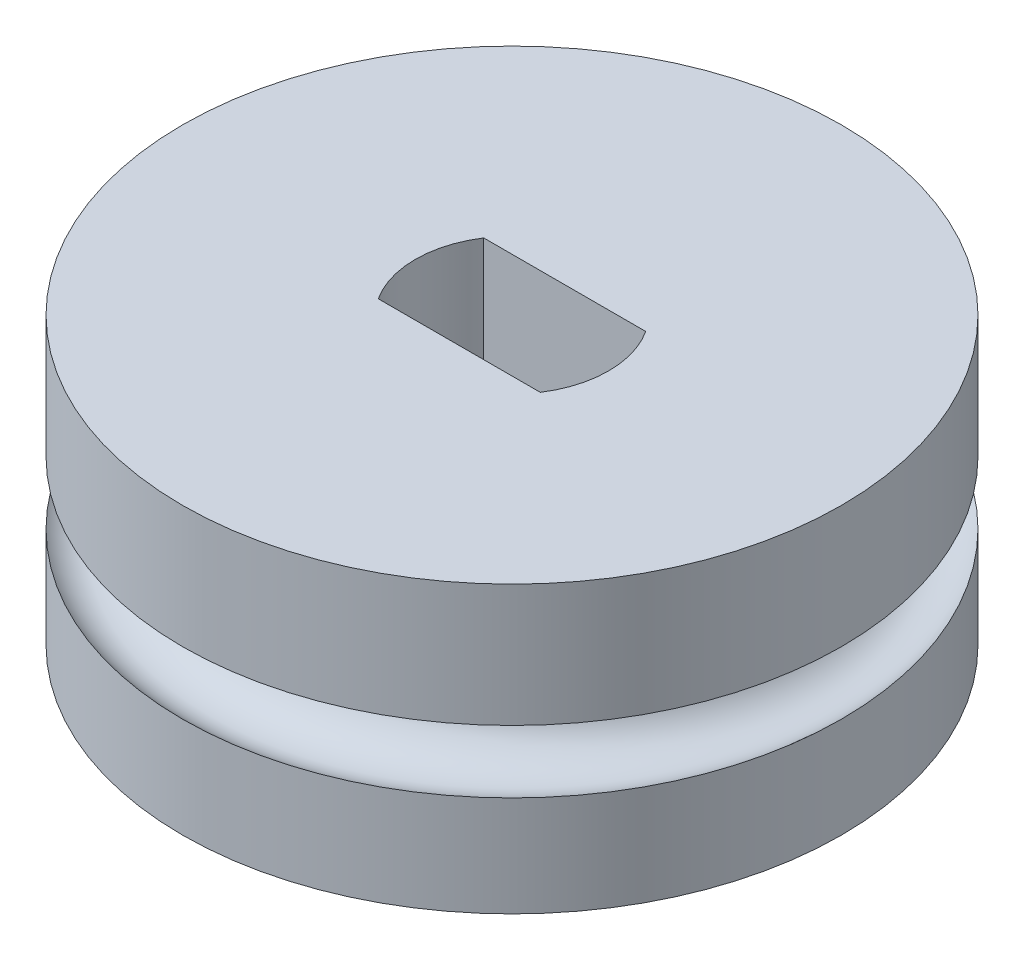
from build123d import *

# Parameters (mm, degrees)
SKETCH_1_R          = 2.75
EXTRUDE_1_DEPTH     = 8
CUT_EXTRUDE_1_DEPTH = 7
EXTRUDE_2_DEPTH     = 3.5
EXTRUDE_START       = -8
SKETCH_5_R          = 7.5
SKETCH_5_R_2        = 2.75
EXTRUDE_3_DEPTH     = 8
SWEEP_1_PROFILE_R   = 1
SKETCH_47_R         = 7.5
SKETCH_47_R_2       = 3.25
CUT_EXTRUDE_3_DEPTH = 1.5
SKETCH_48_R         = 0.8
CUT_EXTRUDE_4_DEPTH = 3.7
CUT_EXTRUDE_6_DEPTH = 3.5


with BuildPart() as part:
    # 草图1 → 凸台-拉伸1 (new body)
    with BuildSketch(Plane(origin=(0, 0, 0), x_dir=(1, 0, 0), z_dir=(0, 1, 0))):
        with Locations(Location((0, 0, 0), (0, 0, 270))):
            Circle(SKETCH_1_R)
    extrude(amount=EXTRUDE_1_DEPTH)

    # 草图2 → 切除-拉伸1 (cut)
    with BuildSketch(Plane(origin=(0, 8, 0), x_dir=(1, 0, 0), z_dir=(0, 1, 0))):
        with BuildLine():
            Line((1.843908891, 1.2), (-1.843908891, 1.2))
            ThreePointArc((-1.843908891, 1.2), (-2.2, 0), (-1.843908891, -1.2))
            Line((-1.843908891, -1.2), (1.843908891, -1.2))
            ThreePointArc((1.843908891, -1.2), (2.109099282, -0.625859584), (2.2, 0))
            ThreePointArc((2.2, 0), (2.109099282, 0.625859584), (1.843908891, 1.2))
        make_face()
    extrude(amount=-CUT_EXTRUDE_1_DEPTH, mode=Mode.SUBTRACT)

    # 草图4 → 凸台-拉伸2 (add)
    with BuildSketch(Plane(origin=(0, 8, 0), x_dir=(1, 0, 0), z_dir=(0, 1, 0))):
        with BuildLine():
            ThreePointArc((1.6, 1.2), (0, 2), (-1.6, 1.2))
            Line((-1.6, 1.2), (1.6, 1.2))
        make_face()
        with BuildLine():
            ThreePointArc((-1.6, -1.2), (0, -2), (1.6, -1.2))
            Line((1.6, -1.2), (-1.6, -1.2))
        make_face()
    extrude(amount=EXTRUDE_2_DEPTH)

    # 草图5 → 凸台-拉伸3 (add)
    with BuildSketch(Plane(origin=(0, 8, 0), x_dir=(1, 0, 0), z_dir=(0, 1, 0)).offset(EXTRUDE_START)):
        with Locations(Location((0, 0, 0), (0, 0, 270))):
            Circle(SKETCH_5_R)
        Circle(SKETCH_5_R_2, mode=Mode.SUBTRACT)
    extrude(amount=EXTRUDE_3_DEPTH)

    # 切除-扫描1: sweep along a path in 草图16
    with BuildLine(Plane(origin=(0, 4.5, 0), x_dir=(-1, 0, 0), z_dir=(0, -1, 0))) as sweep_1_path:
        CenterArc((0, 0), 6.8, 0, 360)
    # 切除-扫描1 profile (on start of the path) → 切除-扫描1 (sweep, cut)
    with BuildSketch(Plane(origin=(-6.8, 4.5, 0), x_dir=(-1, 0, 0), z_dir=(0, 0, -1))):
        Circle(SWEEP_1_PROFILE_R)
    sweep(path=sweep_1_path.line, mode=Mode.SUBTRACT)

    # 草图47 → 切除-拉伸3 (cut)
    with BuildSketch(Plane.XZ):
        with Locations(Location((0, 0, 0), (0, 0, 270))):
            Circle(SKETCH_47_R)
        with Locations(Location((0, 0, 0), (0, 0, 270))):
            Circle(SKETCH_47_R_2, mode=Mode.SUBTRACT)
    extrude(amount=-CUT_EXTRUDE_3_DEPTH, mode=Mode.SUBTRACT)

    # 草图48 → 切除-拉伸4 (cut)
    with BuildSketch(Plane.XZ.offset(-1.5)):
        with Locations(Location((-5.7, 0, 0), (0, 0, 270))):
            Circle(SKETCH_48_R)
    extrude(amount=-CUT_EXTRUDE_4_DEPTH, mode=Mode.SUBTRACT)

    # 草图56 → 切除-拉伸6 (cut)
    with BuildSketch(Plane(origin=(0, 8, 0), x_dir=(1, 0, 0), z_dir=(0, 1, 0))):
        with BuildLine():
            Line((1.6, -1.2), (-1.6, -1.2))
            ThreePointArc((-1.6, -1.2), (0, -2), (1.6, -1.2))
        make_face()
        with BuildLine():
            Line((-1.6, 1.2), (1.6, 1.2))
            ThreePointArc((1.6, 1.2), (0, 2), (-1.6, 1.2))
        make_face()
    extrude(amount=CUT_EXTRUDE_6_DEPTH, mode=Mode.SUBTRACT)


solid = part.part
